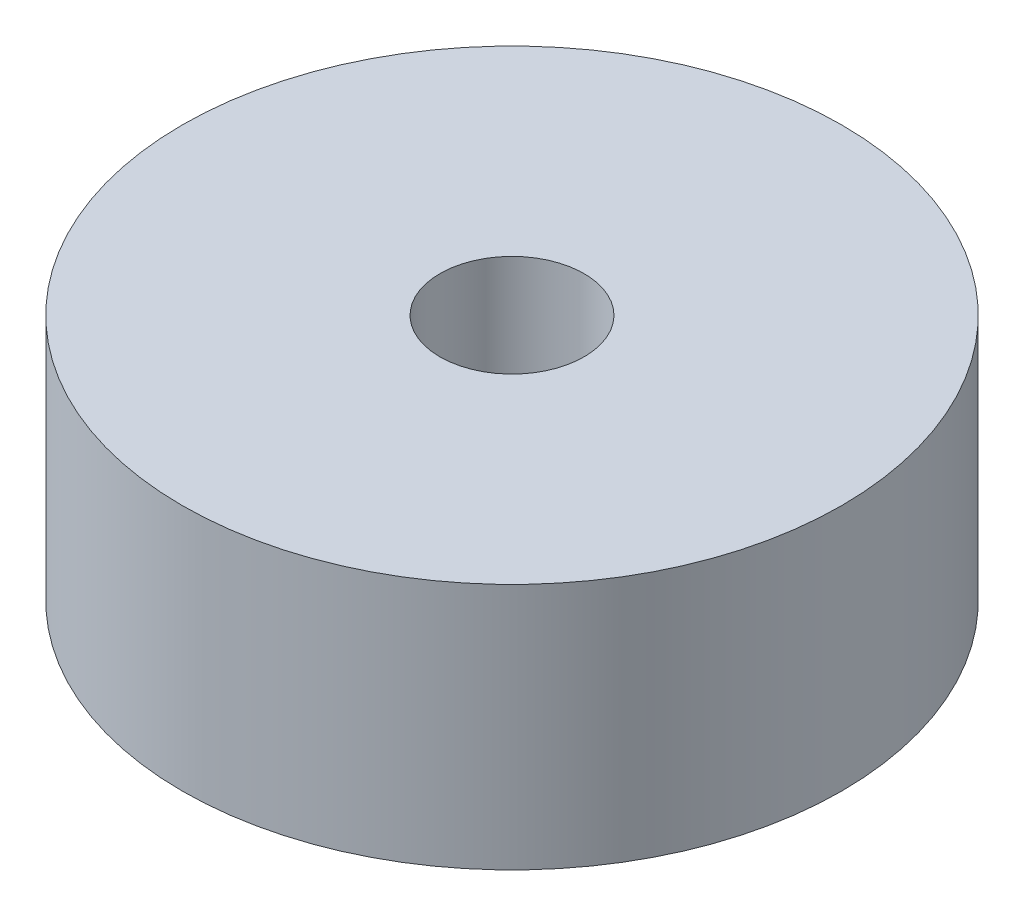
from build123d import *

# Parameters (mm, degrees)
SKETCH1_R           = 4
BOSS_EXTRUDE1_DEPTH = 3
SKETCH2_R           = 0.875
CUT_EXTRUDE1_DEPTH  = 7.403124237


with BuildPart() as part:
    # Sketch1 → Boss-Extrude1 (new body)
    with BuildSketch(Plane(origin=(0, 0, 0), x_dir=(1, 0, 0), z_dir=(0, 1, 0))):
        with Locations(Location((0, 0, 0), (0, 0, 270))):
            Circle(SKETCH1_R)
    extrude(amount=BOSS_EXTRUDE1_DEPTH)

    # Sketch2 → Cut-Extrude1 (cut, through all)
    with BuildSketch(Plane(origin=(0, 3, 0), x_dir=(1, 0, 0), z_dir=(0, 1, 0))):
        with Locations(Location((0, 0, 0), (0, 0, 270))):
            Circle(SKETCH2_R)
    extrude(amount=-CUT_EXTRUDE1_DEPTH, mode=Mode.SUBTRACT)


solid = part.part
